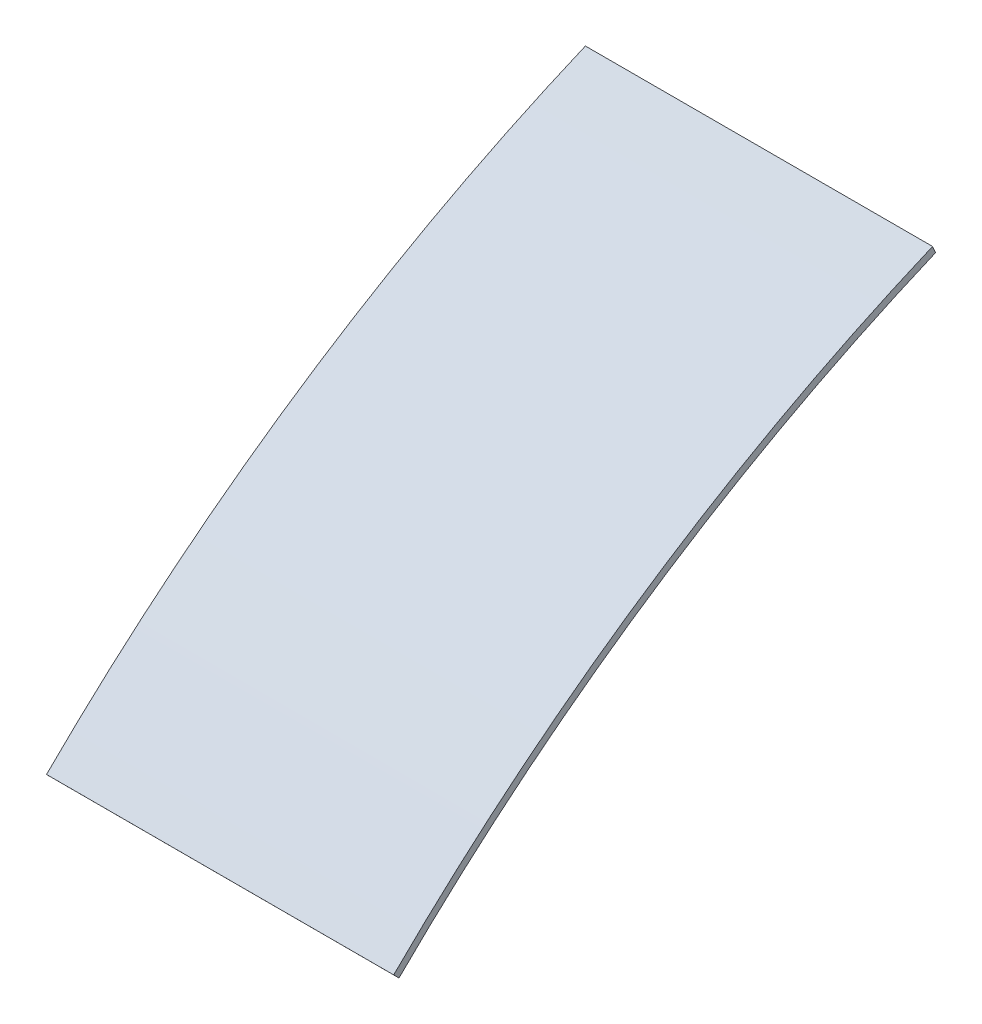
from build123d import *

# Parameters (mm, degrees)
BOSS_EXTRUDE1_DEPTH = 73.1012


with BuildPart() as part:
    # Sketch1 → Boss-Extrude1 (new, symmetric)
    with BuildSketch(Plane(origin=(0, 0, 0), x_dir=(0, 0, -1), z_dir=(1, 0, 0))):
        with BuildLine():
            Line((-225.810623786, -153.325114244), (-224.691047691, -154.450594417))
            ThreePointArc((-224.691047691, -154.450594417), (-119.024013128, -67.811130366), (1.233217804, -2.925713414))
            Line((1.233217804, -2.925713414), (0.616608902, -1.462856707))
            ThreePointArc((0.616608902, -1.462856707), (-119.908343561, -66.492754113), (-225.810623786, -153.325114244))
        make_face()
        with BuildLine():
            Line((-226.93019988, -152.199634071), (-225.810623786, -153.325114244))
            ThreePointArc((-225.810623786, -153.325114244), (-119.908343561, -66.492754113), (0.616608902, -1.462856707))
            Line((0.616608902, -1.462856707), (0, 0))
            ThreePointArc((0, 0), (-120.792673993, -65.17437786), (-226.93019988, -152.199634071))
        make_face()
    extrude(amount=BOSS_EXTRUDE1_DEPTH, both=True)


solid = part.part
